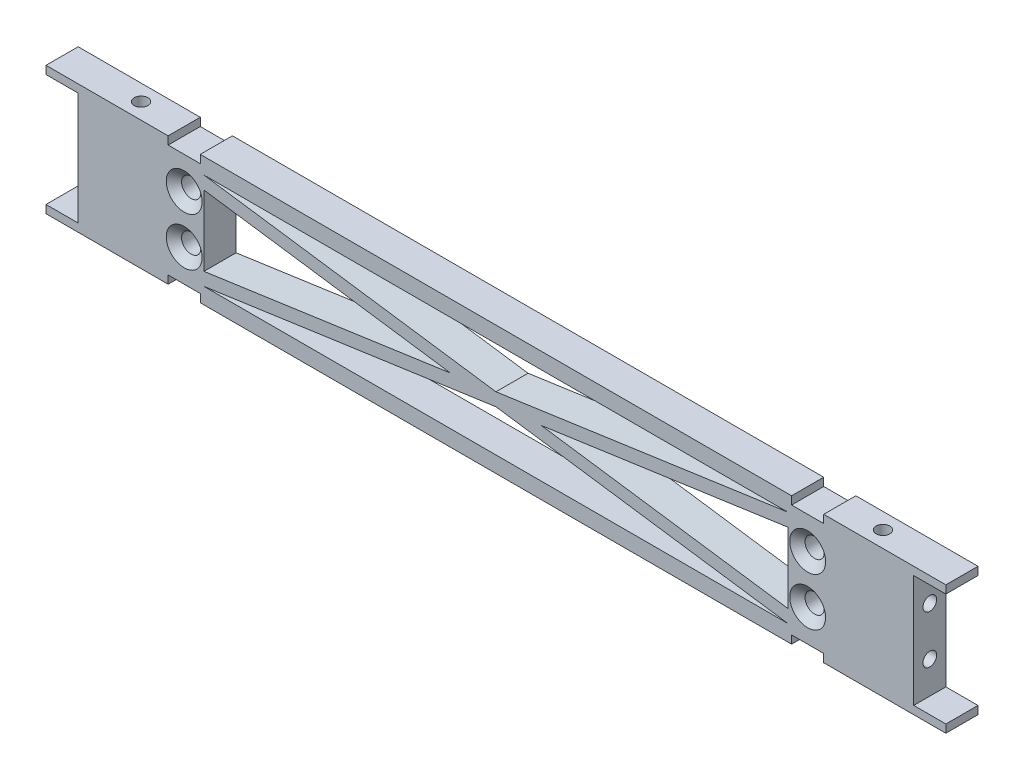
from build123d import *

# Parameters (mm, degrees)
BOSS_EXTRUDE1_DEPTH                               = 6.35
TAP_DRILL_FOR_6_32_TAP1_AT_2_COUNT                = 2
TAP_DRILL_FOR_6_32_TAP1_AT_2_PITCH                = 9.525
SKETCH7_W                                         = 6.35
SKETCH7_H                                         = 1.5875
CUT_EXTRUDE1_DEPTH                                = 91.02678768
CSK_FOR_6_FLAT_HEAD_MACHINE_SCREW_100_D           = 3.7973
CSK_FOR_6_FLAT_HEAD_MACHINE_SCREW_100_CSINK_D     = 7.0866
CSK_FOR_6_FLAT_HEAD_MACHINE_SCREW_100_CSINK_ANGLE = 100


with BuildPart() as part:
    # Sketch1 → Boss-Extrude1 (new body)
    with BuildSketch(Plane.XY):
        Polygon((-57.694743879, -6.959212537), (-57.694743879, 6.959212537), (-82.55, 10.509963411), (-82.55, -10.509963411), align=None)
        Polygon((57.694743879, -9.525), (-57.694743879, -9.525), (-79.919743879, -12.7), (79.919743879, -12.7), align=None)
        Polygon((-57.694743879, -9.525), (-57.694743879, -6.959212537), (-82.55, -10.509963411), (-82.55, -11.1125), (-86.767756121, -11.1125), (-88.9, -11.417106268), (-88.9, -12.7), (-79.919743879, -12.7), align=None)
        Polygon((0, -1.282893732), (-8.980256121, 0), (-57.694743879, -6.959212537), (-57.694743879, -9.525), align=None)
        Polygon((0, 1.282893732), (-57.694743879, 9.525), (-57.694743879, 6.959212537), (-8.980256121, 0), align=None)
        Polygon((79.919743879, 12.7), (-79.919743879, 12.7), (-57.694743879, 9.525), (57.694743879, 9.525), align=None)
        Polygon((-79.919743879, 12.7), (-88.9, 12.7), (-88.9, 11.417106268), (-86.767756121, 11.1125), (-82.55, 11.1125), (-82.55, 10.509963411), (-57.694743879, 6.959212537), (-57.694743879, 9.525), align=None)
        Polygon((57.694743879, -6.959212537), (8.980256121, 0), (0, -1.282893732), (57.694743879, -9.525), align=None)
        Polygon((57.694743879, 6.959212537), (57.694743879, 9.525), (0, 1.282893732), (8.980256121, 0), align=None)
        Polygon((8.980256121, 0), (0, 1.282893732), (-8.980256121, 0), (0, -1.282893732), align=None)
        Polygon((82.55, -10.509963411), (57.694743879, -6.959212537), (57.694743879, -9.525), (79.919743879, -12.7), (88.9, -12.7), (88.9, -11.417106268), (86.767756121, -11.1125), (82.55, -11.1125), align=None)
        Polygon((88.9, 12.7), (79.919743879, 12.7), (57.694743879, 9.525), (57.694743879, 6.959212537), (82.55, 10.509963411), (82.55, 11.1125), (86.767756121, 11.1125), (88.9, 11.417106268), align=None)
        Polygon((88.9, 11.1125), (88.9, 11.417106268), (86.767756121, 11.1125), align=None)
        Polygon((88.9, -11.1125), (86.767756121, -11.1125), (88.9, -11.417106268), align=None)
        Polygon((82.55, 10.509963411), (57.694743879, 6.959212537), (57.694743879, -6.959212537), (82.55, -10.509963411), align=None)
        Polygon((-88.9, -11.417106268), (-86.767756121, -11.1125), (-88.9, -11.1125), align=None)
        Polygon((-86.767756121, 11.1125), (-88.9, 11.417106268), (-88.9, 11.1125), align=None)
    extrude(amount=BOSS_EXTRUDE1_DEPTH)

    # Sketch4 → Tap Drill for #6-32 Tap1 (revolve, cut)
    with BuildSketch(Plane(origin=(-82.55, 4.7625, 3.175), x_dir=(0, 0, 1), z_dir=(0, 1, 0))):
        Polygon((0, 0), (0, 13.51269403), (1.35255, 12.7), (1.35255, 0), align=None)
    tap_drill_for_6_32_tap1 = revolve(axis=Axis((-88.9, 4.7625, 3.175), (1, 0, 0)), mode=Mode.SUBTRACT)

    # Tap Drill for #6-32 Tap1 at 2: Tap Drill for #6-32 Tap1 ×2
    with Locations(*[(0, -i * TAP_DRILL_FOR_6_32_TAP1_AT_2_PITCH, 0) for i in range(1, TAP_DRILL_FOR_6_32_TAP1_AT_2_COUNT)]):
        add(tap_drill_for_6_32_tap1, mode=Mode.SUBTRACT)

    # Mirror1: Tap Drill for #6-32 Tap1 across plane
    add(tap_drill_for_6_32_tap1.mirror(Plane(origin=(0, 0, 0), x_dir=(0, 0, 1), z_dir=(1, 0, 0))), mode=Mode.SUBTRACT)

    # Mirror1 copy 1 sketch → Mirror1 copy 1 (revolve, cut)
    with BuildSketch(Plane(origin=(82.55, -4.7625, 3.175), x_dir=(0, 0, 1), z_dir=(0, 1, 0))):
        Polygon((0, 0), (0, -13.51269403), (1.35255, -12.7), (1.35255, 0), align=None)
    revolve(axis=Axis((88.9, -4.7625, 3.175), (1, 0, 0)), mode=Mode.SUBTRACT)

    # Sketch5 → Tap Drill for #6-32 Tap2 (revolve, cut)
    with BuildSketch(Plane(origin=(-73.289583418, 12.7, 3.175), x_dir=(0, 0, 1), z_dir=(1, 0, 0))):
        Polygon((0, 0), (0, 7.16269403), (1.35255, 6.35), (1.35255, 0), align=None)
    tap_drill_for_6_32_tap2 = revolve(axis=Axis((-73.289583418, 19.05, 3.175), (0, -1, 0)), mode=Mode.SUBTRACT)

    # Mirror2: Tap Drill for #6-32 Tap2 across plane
    add(tap_drill_for_6_32_tap2.mirror(Plane(origin=(0, 0, 0), x_dir=(0, 0, 1), z_dir=(1, 0, 0))), mode=Mode.SUBTRACT)

    # Mirror3: Tap Drill for #6-32 Tap2 across plane
    add(tap_drill_for_6_32_tap2.mirror(Plane(origin=(0, 0, 0), x_dir=(0, 0, 1), z_dir=(0, -1, 0))), mode=Mode.SUBTRACT)

    # Mirror3 copy 1 sketch → Mirror3 copy 1 (revolve, cut)
    with BuildSketch(Plane(origin=(73.289583418, -12.7, 3.175), x_dir=(0, 0, 1), z_dir=(-1, 0, 0))):
        Polygon((0, 0), (0, 7.16269403), (1.35255, 6.35), (1.35255, 0), align=None)
    revolve(axis=Axis((73.289583418, -19.05, 3.175), (0, 1, 0)), mode=Mode.SUBTRACT)

    # Sketch7 → Cut-Extrude1 (cut, through all)
    with BuildSketch(Plane.XY.offset(6.35)):
        with Locations((-61.595, 11.90625)):
            Rectangle(SKETCH7_W, SKETCH7_H)
        with Locations((-61.595, -11.90625)):
            Rectangle(SKETCH7_W, SKETCH7_H)
        with Locations((61.595, -11.90625)):
            Rectangle(SKETCH7_W, SKETCH7_H)
        with Locations((61.595, 11.90625)):
            Rectangle(SKETCH7_W, SKETCH7_H)
    extrude(amount=-CUT_EXTRUDE1_DEPTH, mode=Mode.SUBTRACT)

    # CSK for #6 Flat Head Machine Screw (100)1 (through all)
    with Locations(Plane.XY.offset(6.35)):
        with Locations((-61.595, 4.7625), (-61.595, -4.7625), (61.595, -4.7625), (61.595, 4.7625)):
            CounterSinkHole(CSK_FOR_6_FLAT_HEAD_MACHINE_SCREW_100_D / 2, CSK_FOR_6_FLAT_HEAD_MACHINE_SCREW_100_CSINK_D / 2, counter_sink_angle=CSK_FOR_6_FLAT_HEAD_MACHINE_SCREW_100_CSINK_ANGLE)


solid = part.part
